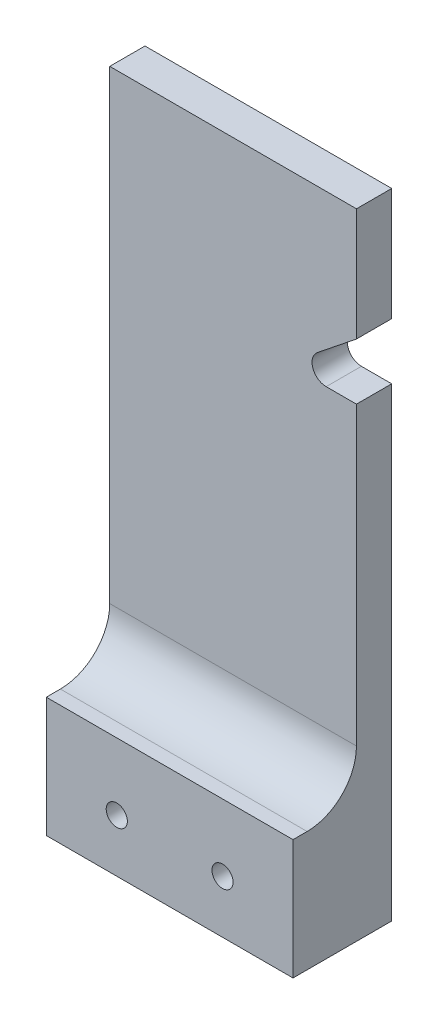
from build123d import *

# Parameters (mm, degrees)
SKETCH_1_W          = 35
SKETCH_1_H          = 90
EXTRUDE_1_DEPTH     = 5
SKETCH_2_W          = 35
SKETCH_2_H          = 17
EXTRUDE_2_DEPTH     = 9
FILLET_1_R          = 7
SKETCH_3_R          = 1.5
CUT_EXTRUDE_3_DEPTH = 51.271761457
CUT_EXTRUDE_4_DEPTH = 51.271761457
FILLET_2_R          = 2


with BuildPart() as part:
    # 草图1 → 凸台-拉伸1 (new body)
    with BuildSketch(Plane.XY):
        Rectangle(SKETCH_1_W, SKETCH_1_H)
    extrude(amount=EXTRUDE_1_DEPTH)

    # 草图2 → 凸台-拉伸2 (add)
    with BuildSketch(Plane.XY.offset(5)):
        with Locations((0, -36.5)):
            Rectangle(SKETCH_2_W, SKETCH_2_H)
    extrude(amount=EXTRUDE_2_DEPTH)

    # 圆角1
    fillet_1_edges = [part.edges().sort_by_distance(p)[0] for p in [
        (0, -28, 5),
    ]]
    fillet(fillet_1_edges, radius=FILLET_1_R)

    # 草图3 → 切除-拉伸3 (cut, through all)
    with BuildSketch(Plane.XY.offset(14)):
        with Locations((-7.5, -37.5)):
            Circle(SKETCH_3_R)
        with Locations((7.5, -37.5)):
            Circle(SKETCH_3_R)
    extrude(amount=-CUT_EXTRUDE_3_DEPTH, mode=Mode.SUBTRACT)

    # 草图4 → 切除-拉伸4 (cut, through all)
    with BuildSketch(Plane(origin=(0, 0, 0), x_dir=(-1, 0, 0), z_dir=(0, 0, -1))):
        Polygon((-17.5, 29), (-17.5, 21), (-7.5, 21), align=None)
    extrude(amount=-CUT_EXTRUDE_4_DEPTH, mode=Mode.SUBTRACT)

    # 圆角2
    fillet_2_edges = [part.edges().sort_by_distance(p)[0] for p in [
        (7.5, 21, 2.5),
    ]]
    fillet(fillet_2_edges, radius=FILLET_2_R)


solid = part.part
